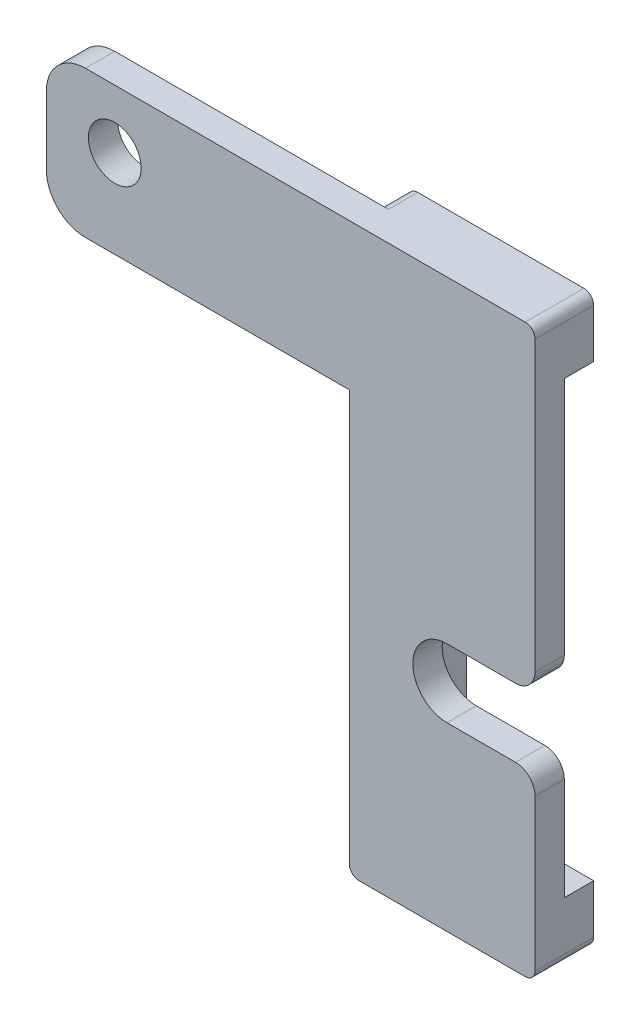
from build123d import *

# Parameters (mm, degrees)
SKETCH1_R           = 2.7
BOSS_EXTRUDE1_DEPTH = 3
BOSS_EXTRUDE2_DEPTH = 3
CUT_EXTRUDE1_DEPTH  = 3
FILLET1_R           = 4
FILLET2_R           = 2
FILLET3_R           = 1


with BuildPart() as part:
    # Sketch1 → Boss-Extrude1 (new body)
    with BuildSketch(Plane.XY):
        Polygon((0, 0), (0, 15), (50, 15), (50, -43), (31, -43), (31, 0), align=None)
        with Locations((7, 9)):
            Circle(SKETCH1_R, mode=Mode.SUBTRACT)
    extrude(amount=-BOSS_EXTRUDE1_DEPTH)

    # Sketch2 → Boss-Extrude2 (add)
    with BuildSketch(Plane(origin=(0, 0, -3), x_dir=(-1, 0, 0), z_dir=(0, 0, -1))):
        Polygon((-50, 15), (-50, 9), (-37, 9), (-37, -37), (-50, -37), (-50, -43), (-31, -43), (-31, 15), align=None)
    extrude(amount=BOSS_EXTRUDE2_DEPTH)

    # Sketch3 → Cut-Extrude1 (cut)
    with BuildSketch(Plane.XY):
        with BuildLine():
            Line((41, -17.5), (50, -17.5))
            Line((50, -17.5), (50, -24.5))
            Line((50, -24.5), (41, -24.5))
            ThreePointArc((41, -24.5), (37.5, -21), (41, -17.5))
        make_face()
    extrude(amount=-CUT_EXTRUDE1_DEPTH, mode=Mode.SUBTRACT)

    # Fillet1
    fillet1_edges = [part.edges().sort_by_distance(p)[0] for p in [
        (0, 0, -1.5),
        (0, 15, -1.5),
    ]]
    fillet(fillet1_edges, radius=FILLET1_R)

    # Fillet2
    fillet2_edges = [part.edges().sort_by_distance(p)[0] for p in [
        (50, -17.5, -1.5),
        (50, -24.5, -1.5),
    ]]
    fillet(fillet2_edges, radius=FILLET2_R)

    # Fillet3
    fillet3_edges = [part.edges().sort_by_distance(p)[0] for p in [
        (50, 15, -3),
        (50, -43, -3),
        (31, -43, -3),
        (31, 15, -4.5),
    ]]
    fillet(fillet3_edges, radius=FILLET3_R)


solid = part.part
